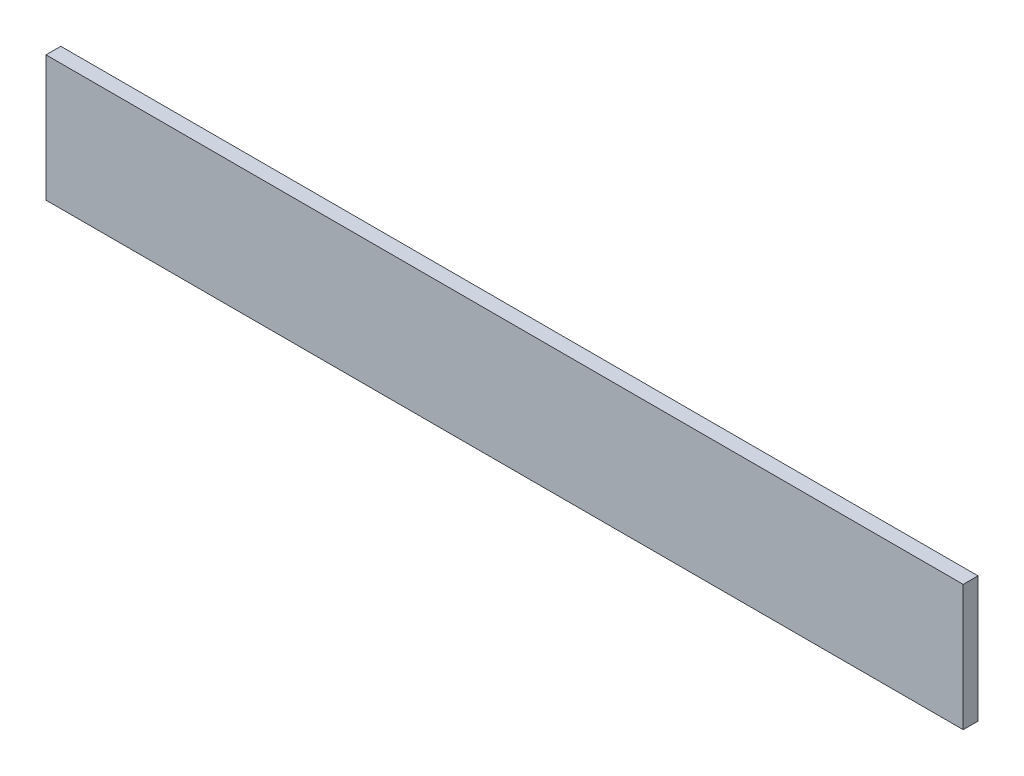
from build123d import *

# Parameters (mm, degrees)
SKETCH1_W           = 619.4
SKETCH1_H           = 85
BOSS_EXTRUDE1_DEPTH = 10
SKETCH2_W           = 599.4
SKETCH2_H           = 65.9
CUT_EXTRUDE1_DEPTH  = 8


with BuildPart() as part:
    # Sketch1 → Boss-Extrude1 (new body)
    with BuildSketch(Plane.XY):
        Rectangle(SKETCH1_W, SKETCH1_H)
    extrude(amount=BOSS_EXTRUDE1_DEPTH)

    # Sketch2 → Cut-Extrude1 (cut)
    with BuildSketch(Plane.XY):
        Rectangle(SKETCH2_W, SKETCH2_H)
    extrude(amount=CUT_EXTRUDE1_DEPTH, mode=Mode.SUBTRACT)


solid = part.part
